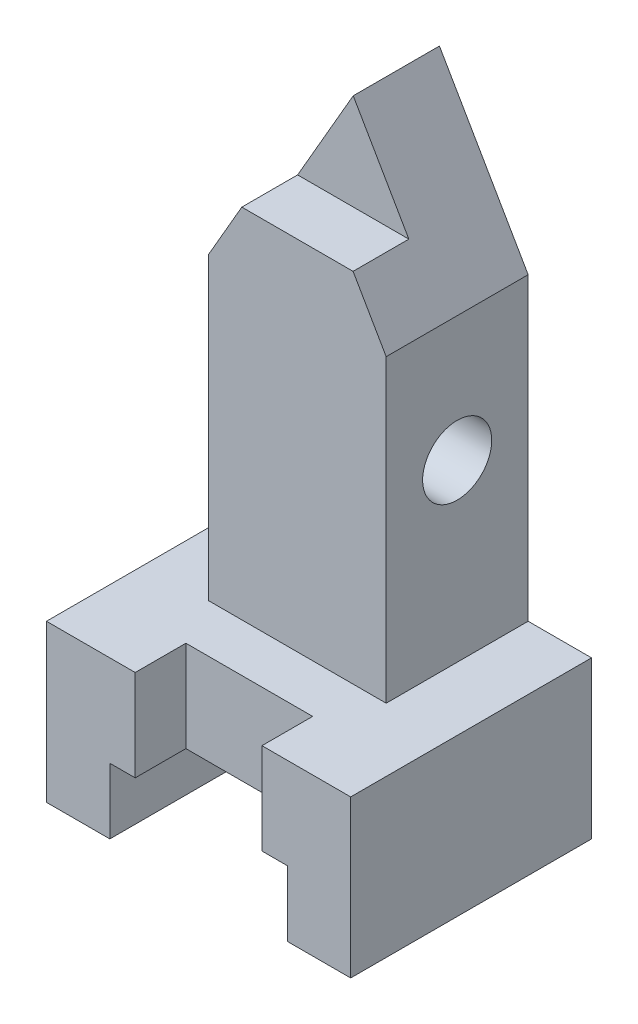
from build123d import *

# Parameters (mm, degrees)
BOSS_EXTRUDE1_DEPTH      = 22.4
SKETCH2_R                = 10.908211602
CUT_EXTRUDE1_DEPTH       = 156.383396796
SKETCH3_W                = 70.975037356
SKETCH3_H                = 39.358884352
CUT_EXTRUDE2_DEPTH       = 17.6
BOSS_EXTRUDE3_DEPTH      = 53.6
BOSS_EXTRUDE3_DEPTH_BACK = 22.4
SKETCH7_W                = 40
SKETCH7_H                = 93.823615884
CUT_EXTRUDE4_DEPTH       = 16


with BuildPart() as part:
    # Sketch1 → Boss-Extrude1 (new, symmetric)
    with BuildSketch(Plane.XY):
        Polygon((-17.666918237, 112.6), (-28, 94.702577388), (-28, 0), (0, 0), (28, 0), (28, 94.702577388), (17.666918237, 112.6), (0, 143.2), align=None)
    extrude(amount=BOSS_EXTRUDE1_DEPTH, both=True)

    # Sketch2 → Cut-Extrude1 (cut, through all)
    with BuildSketch(Plane(origin=(28, 0, 0), x_dir=(0, 0, -1), z_dir=(1, 0, 0))):
        with Locations(Location((0, 55.2, 0), (0, 0, 90))):
            Circle(SKETCH2_R)
    extrude(amount=-CUT_EXTRUDE1_DEPTH, mode=Mode.SUBTRACT)

    # Sketch3 → Cut-Extrude2 (cut)
    with BuildSketch(Plane.XY.offset(22.4)):
        with Locations((-1.700797659, 132.479442176)):
            Rectangle(SKETCH3_W, SKETCH3_H)
    extrude(amount=-CUT_EXTRUDE2_DEPTH, mode=Mode.SUBTRACT)

    # Sketch4 → Boss-Extrude3 (add, two sides: drawn at the far end of the back side and taken through both)
    with BuildSketch(Plane.XY.offset(-BOSS_EXTRUDE3_DEPTH_BACK)):
        Polygon((0, 0), (-28, 0), (-48, 0), (-48, -49.489884121), (-28, -49.489884121), (-28, -28.8), (28, -28.8), (28, -49.489884121), (48, -49.489884121), (48, 0), (28, 0), align=None)
    extrude(amount=BOSS_EXTRUDE3_DEPTH + BOSS_EXTRUDE3_DEPTH_BACK)

    # Sketch7 → Cut-Extrude4 (cut)
    with BuildSketch(Plane.XY.offset(53.6)):
        with Locations((0, -14.4)):
            Rectangle(SKETCH7_W, SKETCH7_H)
    extrude(amount=-CUT_EXTRUDE4_DEPTH, mode=Mode.SUBTRACT)


solid = part.part
